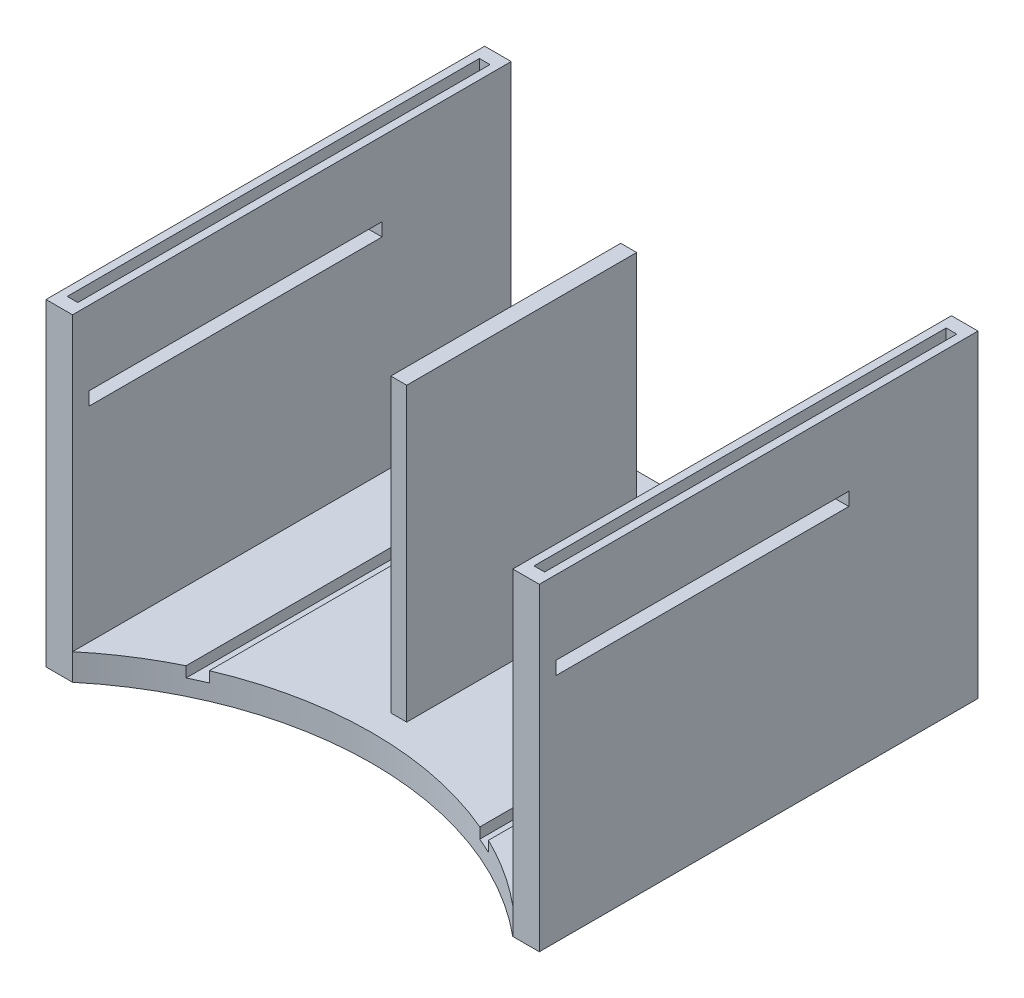
from build123d import *

# Parameters (mm, degrees)
EXTRUDE_THIN2_DEPTH     = 165.4
SKETCH11_W              = 166
SKETCH11_H              = 4
BOSS_EXTRUDE3_DEPTH     = 2.6416
CUT_EXTRUDE6_DEPTH      = 270.69086006
CUT_EXTRUDE6_DEPTH_BACK = 270.69086006
SKETCH13_W              = 110.495011338
SKETCH13_H              = 5
CUT_EXTRUDE7_DEPTH      = 273.127102656
SKETCH19_W              = 4
SKETCH19_H              = 155.4
CUT_EXTRUDE9_DEPTH      = 10
SKETCH20_W              = 4
SKETCH20_H              = 155.4
CUT_EXTRUDE10_DEPTH     = 10
SKETCH21_W              = 6
SKETCH21_H              = 86.697
BOSS_EXTRUDE4_DEPTH     = 110
CUT_EXTRUDE11_DEPTH     = 4
SKETCH23_W              = 166
SKETCH23_H              = 4
BOSS_EXTRUDE5_DEPTH     = 2.6416


with BuildPart() as part:
    # Sketch2 → Extrude-Thin2 (new body)
    with BuildSketch(Plane.XY):
        Polygon((0, 120), (0, 0), (186, 0), (186, 120), (176, 120), (176, 10), (10, 10), (10, 120), align=None)
    extrude(amount=EXTRUDE_THIN2_DEPTH)

    # Sketch11 → Boss-Extrude3 (add)
    with BuildSketch(Plane(origin=(0, 10, 0), x_dir=(1, 0, 0), z_dir=(0, 1, 0))):
        with Locations((93, -34.703)):
            Rectangle(SKETCH11_W, SKETCH11_H)
    extrude(amount=BOSS_EXTRUDE3_DEPTH)

    # Sketch13 → Cut-Extrude6 (cut, two sides: drawn at the far end of the back side and taken through both)
    with BuildSketch(Plane(origin=(10, 0, 0), x_dir=(0, 0, -1), z_dir=(1, 0, 0)).offset(-CUT_EXTRUDE6_DEPTH_BACK)):
        with Locations((-103.947505669, 89.551599899)):
            Rectangle(SKETCH13_W, SKETCH13_H)
    extrude(amount=CUT_EXTRUDE6_DEPTH + CUT_EXTRUDE6_DEPTH_BACK, mode=Mode.SUBTRACT)

    # Sketch14 → Cut-Extrude7 (cut, through all)
    with BuildSketch(Plane(origin=(0, 10, 0), x_dir=(1, 0, 0), z_dir=(0, 1, 0))):
        with BuildLine():
            Line((176, -165.4), (10, -165.4))
            ThreePointArc((10, -165.4), (93, -135.4), (176, -165.4))
        make_face()
    extrude(amount=-CUT_EXTRUDE7_DEPTH, mode=Mode.SUBTRACT)

    # Sketch19 → Cut-Extrude9 (cut)
    with BuildSketch(Plane(origin=(0, 120, 0), x_dir=(1, 0, 0), z_dir=(0, 1, 0))):
        with Locations((5, -82.7)):
            Rectangle(SKETCH19_W, SKETCH19_H)
    extrude(amount=-CUT_EXTRUDE9_DEPTH, mode=Mode.SUBTRACT)

    # Sketch20 → Cut-Extrude10 (cut)
    with BuildSketch(Plane(origin=(0, 120, 0), x_dir=(1, 0, 0), z_dir=(0, 1, 0))):
        with Locations((181, -82.7)):
            Rectangle(SKETCH20_W, SKETCH20_H)
    extrude(amount=-CUT_EXTRUDE10_DEPTH, mode=Mode.SUBTRACT)

    # Sketch21 → Boss-Extrude4 (add, through all)
    with BuildSketch(Plane(origin=(0, 10, 0), x_dir=(1, 0, 0), z_dir=(0, 1, 0))):
        with Locations((93, -82.0515)):
            Rectangle(SKETCH21_W, SKETCH21_H)
    extrude(amount=BOSS_EXTRUDE4_DEPTH)

    # Sketch22 → Cut-Extrude11 (cut)
    with BuildSketch(Plane(origin=(0, 10, 0), x_dir=(1, 0, 0), z_dir=(0, 1, 0))):
        Polygon((36, -48.703), (36, -148.583194008), (42, -145.837577441), (42, -48.703), align=None)
        Polygon((144, -145.837577441), (150, -148.583194008), (150, -48.703), (144, -48.703), align=None)
    extrude(amount=-CUT_EXTRUDE11_DEPTH, mode=Mode.SUBTRACT)

    # Sketch23 → Boss-Extrude5 (add)
    with BuildSketch(Plane(origin=(0, 10, 0), x_dir=(1, 0, 0), z_dir=(0, 1, 0))):
        with Locations((93, -27.4)):
            Rectangle(SKETCH23_W, SKETCH23_H)
    extrude(amount=BOSS_EXTRUDE5_DEPTH)


solid = part.part
